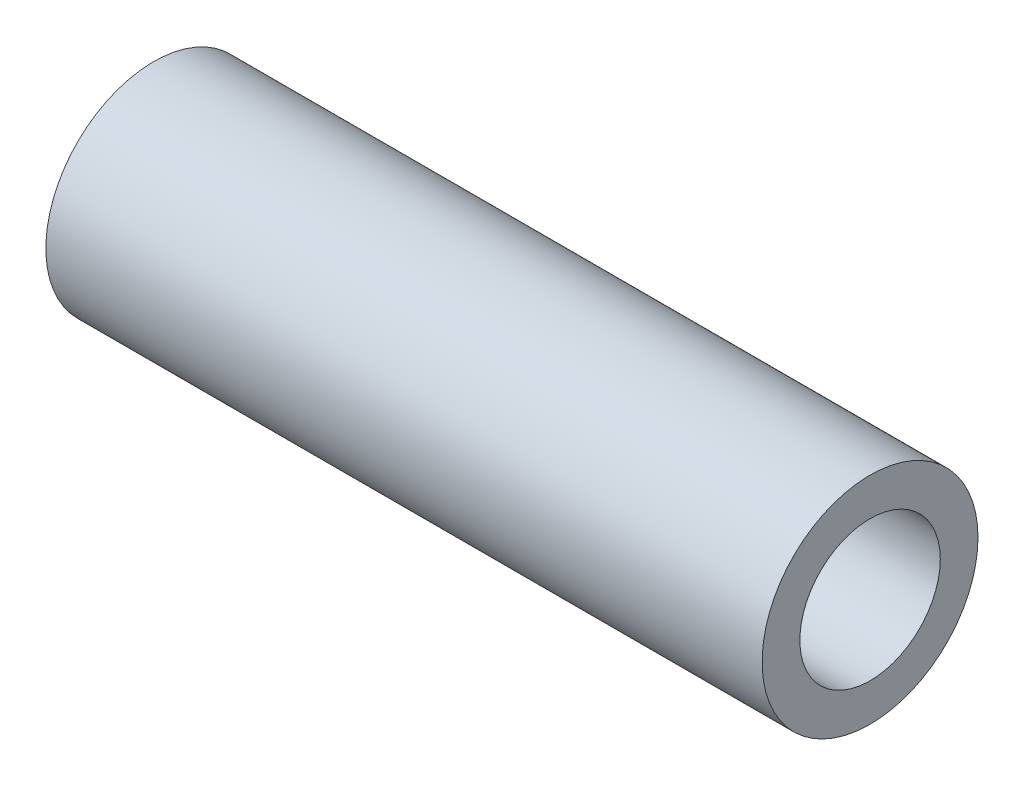
from build123d import *

# Parameters (mm, degrees)
SKETCH1_R      = 1.952177969
SKETCH1_R_2    = 1.27
EXTRUDE1_DEPTH = 6.477


with BuildPart() as part:
    # Sketch1 → Extrude1 (new, symmetric)
    with BuildSketch(Plane(origin=(0, 0, 0), x_dir=(0, 0, -1), z_dir=(1, 0, 0))):
        Circle(SKETCH1_R)
        Circle(SKETCH1_R_2, mode=Mode.SUBTRACT)
    extrude(amount=EXTRUDE1_DEPTH, both=True)


solid = part.part
